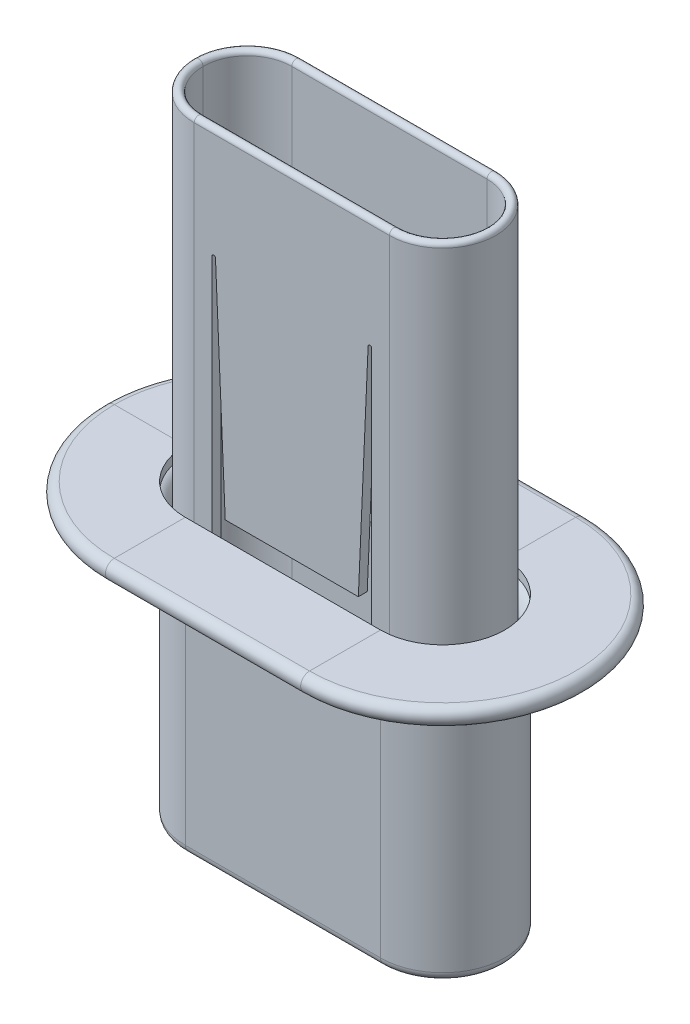
from build123d import *

# Parameters (mm, degrees)
CUT_EXTRUDE1_REACH = 7.38


with BuildPart() as part:
    # Sweep1: sweep along a path in Sketch2
    with BuildLine(Plane(origin=(0, 0, 0), x_dir=(1, 0, 0), z_dir=(0, 1, 0))) as sweep1_path:
        Line((-1.1, 0.5), (1.1, 0.5))
        ThreePointArc((1.1, 0.5), (1.6, 0), (1.1, -0.5))
        Line((1.1, -0.5), (-1.1, -0.5))
        ThreePointArc((-1.1, -0.5), (-1.6, 0), (-1.1, 0.5))
    # Sketch1 → Sweep1 (sweep)
    with BuildSketch(Plane.XY):
        with BuildLine():
            Line((-1.6, 4.05), (-1.6, -2.95))
            ThreePointArc((-1.6, -2.95), (-1.7, -3.05), (-1.8, -2.95))
            Line((-1.8, -2.95), (-1.8, 0))
            ThreePointArc((-1.8, 0), (-1.814644661, 0.035355339), (-1.85, 0.05))
            Line((-1.85, 0.05), (-2.6, 0.05))
            ThreePointArc((-2.6, 0.05), (-2.7, 0.15), (-2.6, 0.25))
            Line((-2.6, 0.25), (-1.8, 0.25))
            Line((-1.8, 0.25), (-1.8, 0.15))
            Line((-1.8, 0.15), (-1.85, 0.15))
            ThreePointArc((-1.85, 0.15), (-1.743933983, 0.106066017), (-1.7, 0))
            Line((-1.7, 0), (-1.7, 4.05))
            ThreePointArc((-1.7, 4.05), (-1.65, 4.1), (-1.6, 4.05))
        make_face()
    sweep(path=sweep1_path.line)

    # Cut-Extrude1: up to this face of the body (flat: up to its plane)
    cut_extrude1_end = Plane(part.part.faces().sort_by_distance((0, 2.025, 0.6))[0])
    # Sketch6 → Cut-Extrude1 (cut, up to the picked face)
    with BuildSketch(Plane(origin=(0, 0, -0.6), x_dir=(-1, 0, 0), z_dir=(0, 0, -1)), mode=Mode.PRIVATE) as cut_extrude1_sk1:
        with BuildLine():
            Line((-0.86, 2.85), (-0.75, 0.35))
            Line((-0.75, 0.35), (0.75, 0.35))
            Line((0.75, 0.35), (0.86, 2.85))
            ThreePointArc((0.86, 2.85), (0.88, 2.87), (0.9, 2.85))
            Line((0.9, 2.85), (0.9, 0.05))
            Line((0.9, 0.05), (-0.9, 0.05))
            Line((-0.9, 0.05), (-0.9, 2.85))
            ThreePointArc((-0.9, 2.85), (-0.88, 2.87), (-0.86, 2.85))
        make_face()
    cut_extrude1_tool1 = split(extrude(cut_extrude1_sk1.sketch, amount=-CUT_EXTRUDE1_REACH, mode=Mode.PRIVATE), bisect_by=cut_extrude1_end, keep=Keep.BOTH, mode=Mode.PRIVATE)
    add(cut_extrude1_tool1.solids().sort_by(Axis((0.838423, 1.598529, -0.6), (0, 0, 1)))[0], mode=Mode.SUBTRACT)


solid = part.part
